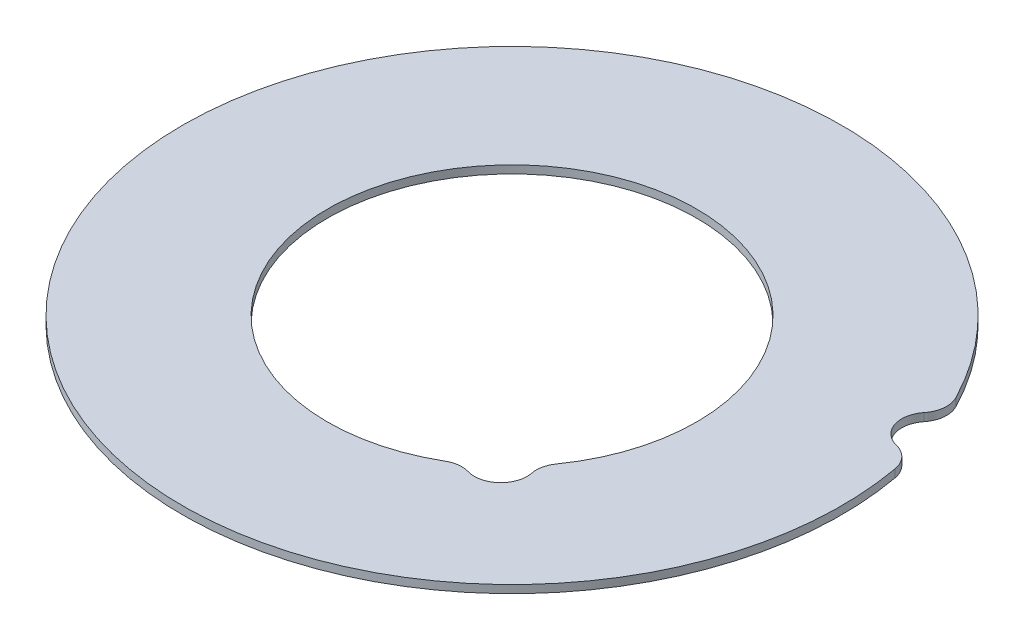
from build123d import *

# Parameters (mm, degrees)
SKETCH1_W          = 5.5
SKETCH1_H          = 0.3
SKETCH2_R          = 1
CUT_EXTRUDE1_DEPTH = 10
FILLET1_R          = 1


with BuildPart() as part:
    # Sketch1 → Revolve1 (revolve)
    with BuildSketch(Plane.XY, mode=Mode.PRIVATE) as revolve1_sk:
        with Locations((-9.75, 0.15)):
            Rectangle(SKETCH1_W, SKETCH1_H)
    revolve(revolve1_sk.sketch.rotate(Axis((0, 0, 0), (0, 1, 0)), 270), axis=Axis((0, 0, 0), (0, 1, 0)))

    # Sketch2 → Cut-Extrude1 (cut)
    with BuildSketch(Plane(origin=(0, 0.3, 0), x_dir=(1, 0, 0), z_dir=(0, 1, 0))):
        with Locations((4.571073678, -5)):
            Circle(SKETCH2_R)
        with Locations((11.782754706, 4.000000001)):
            Circle(SKETCH2_R)
    extrude(amount=-CUT_EXTRUDE1_DEPTH, mode=Mode.SUBTRACT)

    # Fillet1
    fillet1_edges = [part.edges().sort_by_distance(p)[0] for p in [
        (5.405006845, 0.15, 4.448134553),
        (3.946825109, 0.15, 5.781225783),
        (12.120025306, 0.15, -3.058592256),
        (11.47719417, 0.15, -4.952172652),
    ]]
    fillet(fillet1_edges, radius=FILLET1_R)


solid = part.part
